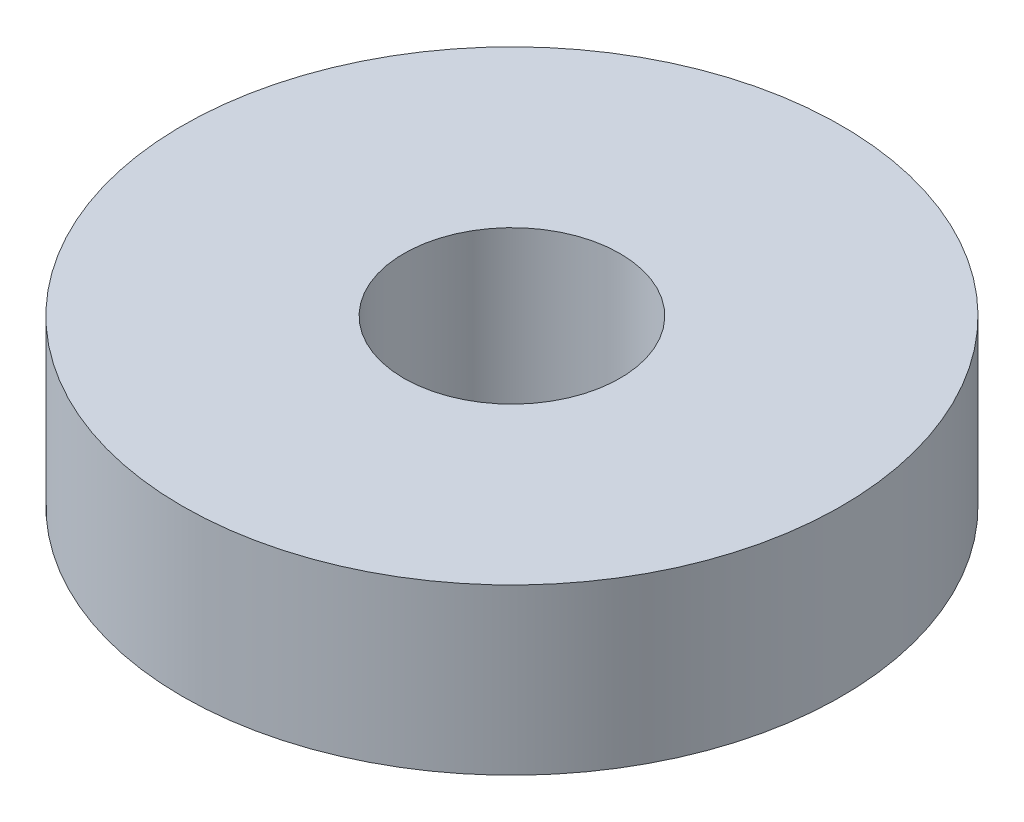
from build123d import *

# Parameters (mm, degrees)
SKETCH1_R           = 6.35
SKETCH1_R_2         = 2.0828
BOSS_EXTRUDE1_DEPTH = 3.175


with BuildPart() as part:
    # Sketch1 → Boss-Extrude1 (new body)
    with BuildSketch(Plane(origin=(0, 0, 0), x_dir=(1, 0, 0), z_dir=(0, 1, 0))):
        with Locations(Location((0, 0, 0), (0, 0, 270))):
            Circle(SKETCH1_R)
        with Locations(Location((0, 0, 0), (0, 0, 270))):
            Circle(SKETCH1_R_2, mode=Mode.SUBTRACT)
    extrude(amount=BOSS_EXTRUDE1_DEPTH)


solid = part.part
